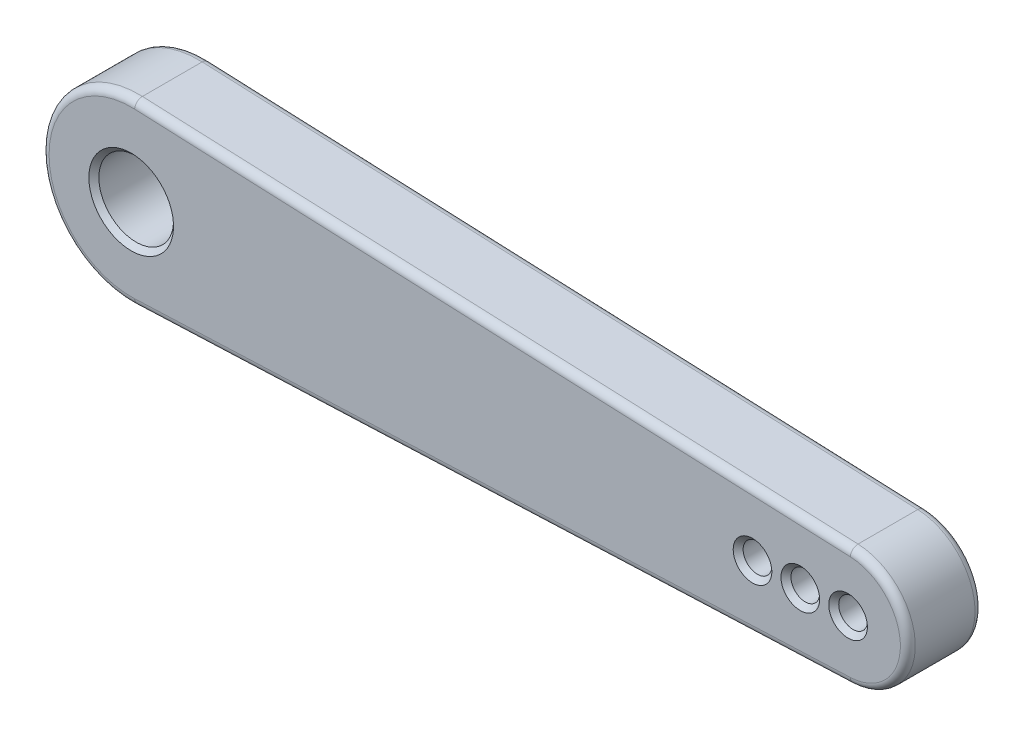
from build123d import *

# Parameters (mm, degrees)
SKETCH1_R           = 3.96875
SKETCH1_R_2         = 1.524
BOSS_EXTRUDE1_DEPTH = 7.9375
FILLET2_R           = 0.79375
CHAMFER1_SIZE       = 0.529166667


with BuildPart() as part:
    # Sketch1 → Boss-Extrude1 (new body)
    with BuildSketch(Plane.XY):
        with BuildLine():
            Line((-37.703125, 9.516728179), (38.364583333, 6.344485453))
            ThreePointArc((38.364583333, 6.344485453), (44.45, 0), (38.364583333, -6.344485453))
            Line((38.364583333, -6.344485453), (-37.703125, -9.516728179))
            ThreePointArc((-37.703125, -9.516728179), (-47.625, 0), (-37.703125, 9.516728179))
        make_face()
        with Locations((-38.1, 0)):
            Circle(SKETCH1_R, mode=Mode.SUBTRACT)
        with Locations((38.1, 0)):
            Circle(SKETCH1_R_2, mode=Mode.SUBTRACT)
        with Locations((33.02, 0)):
            Circle(SKETCH1_R_2, mode=Mode.SUBTRACT)
        with Locations((27.94, 0)):
            Circle(SKETCH1_R_2, mode=Mode.SUBTRACT)
    extrude(amount=BOSS_EXTRUDE1_DEPTH)

    # Fillet2
    fillet2_edges = [part.edges().sort_by_distance(p)[0] for p in [
        (44.45, 0, 7.9375),
        (0.330729167, 7.930606816, 7.9375),
        (-47.625, 0, 7.9375),
        (0.330729167, 7.930606816, 0),
        (44.45, 0, 0),
        (0.330729167, -7.930606816, 0),
        (-47.625, 0, 0),
        (0.330729167, -7.930606816, 7.9375),
    ]]
    fillet(fillet2_edges, radius=FILLET2_R)

    # Chamfer1
    chamfer1_edges = [part.edges().sort_by_distance(p)[0] for p in [
        (-42.06875, 0, 0),
        (-42.06875, 0, 7.9375),
        (36.576, 0, 0),
        (36.576, 0, 7.9375),
        (31.496, 0, 0),
        (31.496, 0, 7.9375),
        (26.416, 0, 0),
        (26.416, 0, 7.9375),
    ]]
    chamfer(chamfer1_edges, length=CHAMFER1_SIZE)


solid = part.part
